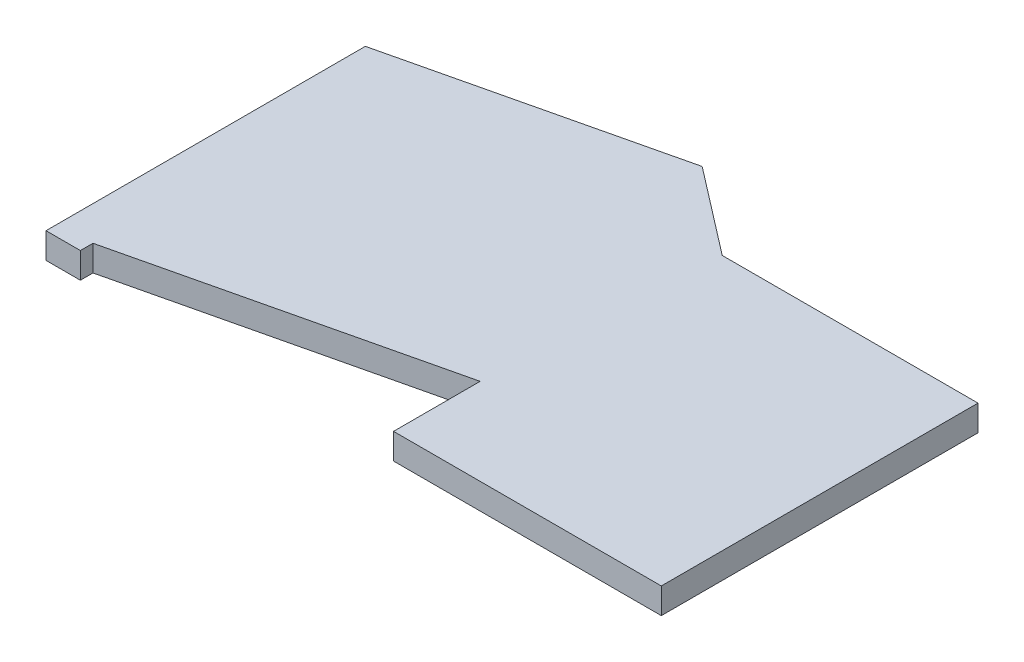
from build123d import *

# Parameters (mm, degrees)
BOSS_EXTRUDE1_DEPTH = 2.54


with BuildPart() as part:
    # Sketch1 → Boss-Extrude1 (new body)
    with BuildSketch(Plane(origin=(0, 70.242231191, 0), x_dir=(1, 0, 0), z_dir=(0, 1, 0))):
        Polygon((64.165955613, -146.185273256), (61.879955613, -146.185273256), (38.933527733, -146.185273256), (38.865036649, -146.132559408), (30.342575426, -139.57328622), (27.988259253, -140.129696922), (24.280403306, -141.005998397), (9.448979516, -144.511204294), (5.741123569, -145.387505768), (3.464799506, -145.925484093), (3.464799506, -177.427273256), (6.856024199, -177.427273256), (6.856024199, -176.182680272), (37.749955613, -168.881318507), (37.749955613, -177.427273256), (64.165955613, -177.427273256), align=None)
    extrude(amount=BOSS_EXTRUDE1_DEPTH)


solid = part.part
